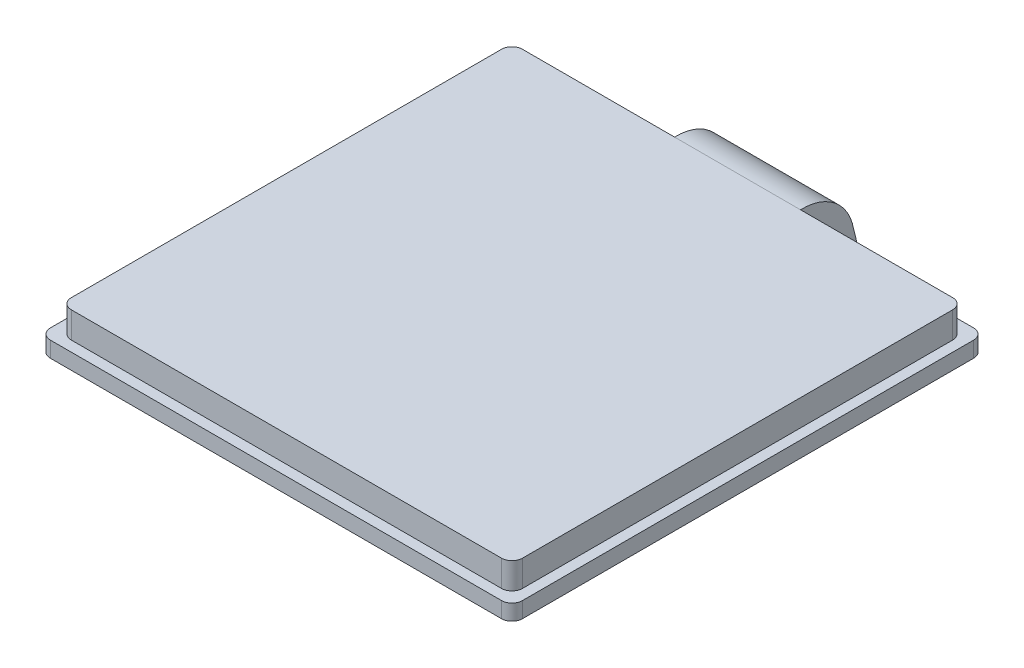
from build123d import *

# Parameters (mm, degrees)
BOSS_EXTRUDE1_DEPTH      = 15
BOSS_EXTRUDE2_DEPTH      = 25
SHELL1_T                 = -5
BOSS_EXTRUDE9_DEPTH      = 60
BOSS_EXTRUDE9_DEPTH_BACK = 60
SKETCH3_R                = 10
SKETCH4_W                = 80
SKETCH4_H                = 45.141945931
CUT_EXTRUDE2_DEPTH       = 377


with BuildPart() as part:
    # Sketch1 → Boss-Extrude1 (new body)
    with BuildSketch(Plane(origin=(0, 0, 0), x_dir=(1, 0, 0), z_dir=(0, 1, 0))):
        with BuildLine():
            Line((-215, 225), (215, 225))
            ThreePointArc((215, 225), (222.071067812, 222.071067812), (225, 215))
            Line((225, 215), (225, -215))
            ThreePointArc((225, -215), (222.071067812, -222.071067812), (215, -225))
            Line((215, -225), (-215, -225))
            ThreePointArc((-215, -225), (-222.071067812, -222.071067812), (-225, -215))
            Line((-225, -215), (-225, 215))
            ThreePointArc((-225, 215), (-222.071067812, 222.071067812), (-215, 225))
        make_face()
        with BuildLine():
            Line((-205, 215), (205, 215))
            ThreePointArc((205, 215), (212.071067812, 212.071067812), (215, 205))
            Line((215, 205), (215, -205))
            ThreePointArc((215, -205), (212.071067812, -212.071067812), (205, -215))
            Line((205, -215), (-205, -215))
            ThreePointArc((-205, -215), (-212.071067812, -212.071067812), (-215, -205))
            Line((-215, -205), (-215, 205))
            ThreePointArc((-215, 205), (-212.071067812, 212.071067812), (-205, 215))
        make_face(mode=Mode.SUBTRACT)
    extrude(amount=BOSS_EXTRUDE1_DEPTH)


with BuildPart() as body_2:
    # Sketch2 → Boss-Extrude2 (new body)
    with BuildSketch(Plane(origin=(0, 15, 0), x_dir=(1, 0, 0), z_dir=(0, 1, 0))):
        with BuildLine():
            Line((-205, -215), (205, -215))
            ThreePointArc((205, -215), (212.071067812, -212.071067812), (215, -205))
            Line((215, -205), (215, 205))
            ThreePointArc((215, 205), (212.071067812, 212.071067812), (205, 215))
            Line((205, 215), (-205, 215))
            ThreePointArc((-205, 215), (-212.071067812, 212.071067812), (-215, 205))
            Line((-215, 205), (-215, -205))
            ThreePointArc((-215, -205), (-212.071067812, -212.071067812), (-205, -215))
        make_face()
    extrude(amount=BOSS_EXTRUDE2_DEPTH)

    # Shell1
    shell1_openings = [body_2.faces().sort_by_distance(p)[0] for p in [
        (0, 15, 0),
    ]]
    offset(amount=SHELL1_T, openings=shell1_openings, kind=Kind.INTERSECTION)


with BuildPart() as body_3:
    # Sketch3 → Boss-Extrude9 (new, two sides: drawn at the far end of the back side and taken through both)
    with BuildSketch(Plane(origin=(0, 0, 0), x_dir=(0, 0, -1), z_dir=(1, 0, 0)).offset(-BOSS_EXTRUDE9_DEPTH_BACK)):
        with BuildLine():
            Line((264.296973896, 4.212622215), (271.284873642, -24.379992565))
            ThreePointArc((271.284873642, -24.379992565), (246.537479386, -38.792109825), (233.206154552, -13.4461353))
            ThreePointArc((233.206154552, -13.4461353), (238.326144926, 9.880009626), (215, 15))
            Line((215, 15), (215, 40))
            ThreePointArc((215, 40), (245.834951571, 30.628142096), (264.296973896, 4.212622215))
        make_face()
        with Locations((251.284873642, -20)):
            Circle(SKETCH3_R, mode=Mode.SUBTRACT)
    extrude(amount=BOSS_EXTRUDE9_DEPTH + BOSS_EXTRUDE9_DEPTH_BACK)

    # Sketch4 → Cut-Extrude2 (cut)
    with BuildSketch(Plane.XY):
        with Locations((0, -23.230591545)):
            Rectangle(SKETCH4_W, SKETCH4_H)
    extrude(amount=-CUT_EXTRUDE2_DEPTH, mode=Mode.SUBTRACT)


solid = Compound([part.part, body_2.part, body_3.part])
